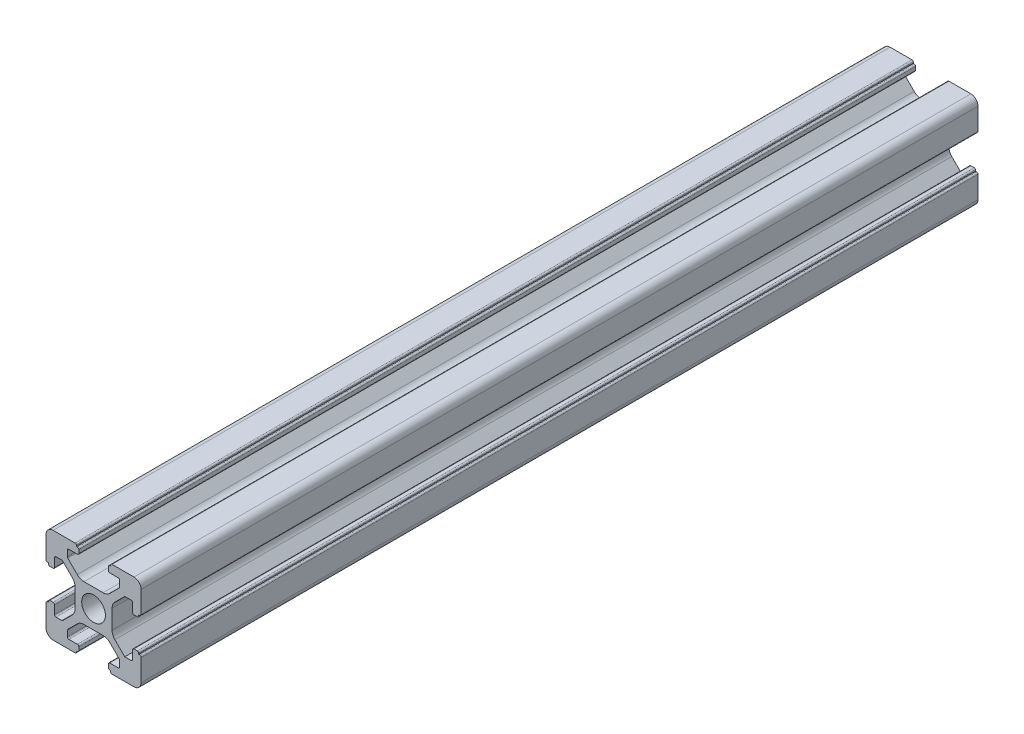
from build123d import *

# Parameters (mm, degrees)
SKETCH_1_R      = 2.5
EXTRUDE_1_DEPTH = 176


with BuildPart() as part:
    # 草图1 → 凸台-拉伸1 (new body)
    with BuildSketch(Plane.XY):
        with BuildLine():
            Line((3.9, 0), (3.9, -2.010912703))
            ThreePointArc((3.9, -2.010912703), (4.052240935, -2.776279568), (4.485786438, -3.425126266))
            Line((4.485786438, -3.425126266), (6.560660172, -5.5))
            Line((6.560660172, -5.5), (7.9, -5.5))
            ThreePointArc((7.9, -5.5), (8.112132034, -5.412132034), (8.2, -5.2))
            Line((8.2, -5.2), (8.2, -3.4))
            ThreePointArc((8.2, -3.4), (8.287867966, -3.187867966), (8.5, -3.1))
            Line((8.5, -3.1), (9.2, -3.1))
            ThreePointArc((9.2, -3.1), (9.412132034, -3.187867966), (9.5, -3.4))
            Line((9.5, -3.4), (9.5, -3.6))
            Line((9.5, -3.6), (9.7, -3.6))
            ThreePointArc((9.7, -3.6), (9.912132034, -3.687867966), (10, -3.9))
            Line((10, -3.9), (10, -8.5))
            ThreePointArc((10, -8.5), (9.560660172, -9.560660172), (8.5, -10))
            Line((8.5, -10), (3.9, -10))
            ThreePointArc((3.9, -10), (3.687867966, -9.912132034), (3.6, -9.7))
            ThreePointArc((3.6, -9.7), (3.541421356, -9.558578644), (3.4, -9.5))
            ThreePointArc((3.4, -9.5), (3.187867966, -9.412132034), (3.1, -9.2))
            Line((3.1, -9.2), (3.1, -8.5))
            ThreePointArc((3.1, -8.5), (3.187867966, -8.287867966), (3.4, -8.2))
            Line((3.4, -8.2), (5.2, -8.2))
            ThreePointArc((5.2, -8.2), (5.412132034, -8.112132034), (5.5, -7.9))
            Line((5.5, -7.9), (5.5, -6.68492424))
            ThreePointArc((5.5, -6.68492424), (5.47716386, -6.570119211), (5.412132034, -6.472792206))
            Line((5.412132034, -6.472792206), (3.425126266, -4.485786438))
            ThreePointArc((3.425126266, -4.485786438), (2.776279568, -4.052240935), (2.010912703, -3.9))
            Line((2.010912703, -3.9), (0, -3.9))
            Line((0, -3.9), (-2.010912703, -3.9))
            ThreePointArc((-2.010912703, -3.9), (-2.776279568, -4.052240935), (-3.425126266, -4.485786438))
            Line((-3.425126266, -4.485786438), (-5.412132034, -6.472792206))
            ThreePointArc((-5.412132034, -6.472792206), (-5.47716386, -6.570119211), (-5.5, -6.68492424))
            Line((-5.5, -6.68492424), (-5.5, -7.9))
            ThreePointArc((-5.5, -7.9), (-5.412132034, -8.112132034), (-5.2, -8.2))
            Line((-5.2, -8.2), (-3.4, -8.2))
            ThreePointArc((-3.4, -8.2), (-3.187867966, -8.287867966), (-3.1, -8.5))
            Line((-3.1, -8.5), (-3.1, -9.2))
            ThreePointArc((-3.1, -9.2), (-3.187867966, -9.412132034), (-3.4, -9.5))
            ThreePointArc((-3.4, -9.5), (-3.541421356, -9.558578644), (-3.6, -9.7))
            ThreePointArc((-3.6, -9.7), (-3.687867966, -9.912132034), (-3.9, -10))
            Line((-3.9, -10), (-8.5, -10))
            ThreePointArc((-8.5, -10), (-9.560660172, -9.560660172), (-10, -8.5))
            Line((-10, -8.5), (-10, -3.9))
            ThreePointArc((-10, -3.9), (-9.912132034, -3.687867966), (-9.7, -3.6))
            Line((-9.7, -3.6), (-9.5, -3.6))
            Line((-9.5, -3.6), (-9.5, -3.4))
            ThreePointArc((-9.5, -3.4), (-9.412132034, -3.187867966), (-9.2, -3.1))
            Line((-9.2, -3.1), (-8.5, -3.1))
            ThreePointArc((-8.5, -3.1), (-8.287867965, -3.187867966), (-8.2, -3.4))
            Line((-8.2, -3.4), (-8.2, -5.2))
            ThreePointArc((-8.2, -5.2), (-8.112132034, -5.412132034), (-7.9, -5.5))
            Line((-7.9, -5.5), (-6.68492424, -5.5))
            ThreePointArc((-6.68492424, -5.5), (-6.570119211, -5.47716386), (-6.472792206, -5.412132034))
            Line((-6.472792206, -5.412132034), (-4.485786438, -3.425126266))
            ThreePointArc((-4.485786438, -3.425126266), (-4.052240935, -2.776279568), (-3.9, -2.010912703))
            Line((-3.9, -2.010912703), (-3.9, 0))
            Line((-3.9, 0), (-3.9, 2.010912703))
            ThreePointArc((-3.9, 2.010912703), (-4.052240935, 2.776279568), (-4.485786438, 3.425126266))
            Line((-4.485786438, 3.425126266), (-6.472792206, 5.412132034))
            ThreePointArc((-6.472792206, 5.412132034), (-6.570119211, 5.47716386), (-6.68492424, 5.5))
            Line((-6.68492424, 5.5), (-7.9, 5.5))
            ThreePointArc((-7.9, 5.5), (-8.112132034, 5.412132034), (-8.2, 5.2))
            Line((-8.2, 5.2), (-8.2, 3.4))
            ThreePointArc((-8.2, 3.4), (-8.287867965, 3.187867966), (-8.5, 3.1))
            Line((-8.5, 3.1), (-9.2, 3.1))
            ThreePointArc((-9.2, 3.1), (-9.412132034, 3.187867966), (-9.5, 3.4))
            Line((-9.5, 3.4), (-9.5, 3.6))
            Line((-9.5, 3.6), (-9.7, 3.6))
            ThreePointArc((-9.7, 3.6), (-9.912132034, 3.687867966), (-10, 3.9))
            Line((-10, 3.9), (-10, 8.5))
            ThreePointArc((-10, 8.5), (-9.560660172, 9.560660172), (-8.5, 10))
            Line((-8.5, 10), (-3.9, 10))
            ThreePointArc((-3.9, 10), (-3.687867966, 9.912132034), (-3.6, 9.7))
            Line((-3.6, 9.7), (-3.6, 9.5))
            Line((-3.6, 9.5), (-3.4, 9.5))
            ThreePointArc((-3.4, 9.5), (-3.187867966, 9.412132034), (-3.1, 9.2))
            Line((-3.1, 9.2), (-3.1, 8.5))
            ThreePointArc((-3.1, 8.5), (-3.187867966, 8.287867966), (-3.4, 8.2))
            Line((-3.4, 8.2), (-5.2, 8.2))
            ThreePointArc((-5.2, 8.2), (-5.412132034, 8.112132034), (-5.5, 7.9))
            Line((-5.5, 7.9), (-5.5, 6.68492424))
            ThreePointArc((-5.5, 6.68492424), (-5.47716386, 6.570119211), (-5.412132034, 6.472792206))
            Line((-5.412132034, 6.472792206), (-3.425126266, 4.485786438))
            ThreePointArc((-3.425126266, 4.485786438), (-2.776279568, 4.052240935), (-2.010912703, 3.9))
            Line((-2.010912703, 3.9), (0, 3.9))
            Line((0, 3.9), (2.010912703, 3.9))
            ThreePointArc((2.010912703, 3.9), (2.776279568, 4.052240935), (3.425126266, 4.485786438))
            Line((3.425126266, 4.485786438), (5.412132034, 6.472792206))
            ThreePointArc((5.412132034, 6.472792206), (5.47716386, 6.570119211), (5.5, 6.68492424))
            Line((5.5, 6.68492424), (5.5, 7.9))
            ThreePointArc((5.5, 7.9), (5.412132034, 8.112132034), (5.2, 8.2))
            Line((5.2, 8.2), (3.4, 8.2))
            ThreePointArc((3.4, 8.2), (3.187867966, 8.287867966), (3.1, 8.5))
            Line((3.1, 8.5), (3.1, 9.2))
            ThreePointArc((3.1, 9.2), (3.187867966, 9.412132034), (3.4, 9.5))
            Line((3.4, 9.5), (3.6, 9.5))
            Line((3.6, 9.5), (3.6, 9.7))
            ThreePointArc((3.6, 9.7), (3.687867966, 9.912132034), (3.9, 10))
            Line((3.9, 10), (8.5, 10))
            ThreePointArc((8.5, 10), (9.560660172, 9.560660172), (10, 8.5))
            Line((10, 8.5), (10, 3.9))
            ThreePointArc((10, 3.9), (9.912132034, 3.687867966), (9.7, 3.6))
            Line((9.7, 3.6), (9.5, 3.6))
            Line((9.5, 3.6), (9.5, 3.4))
            ThreePointArc((9.5, 3.4), (9.412132034, 3.187867966), (9.2, 3.1))
            Line((9.2, 3.1), (8.5, 3.1))
            ThreePointArc((8.5, 3.1), (8.287867966, 3.187867966), (8.2, 3.4))
            Line((8.2, 3.4), (8.2, 5.2))
            ThreePointArc((8.2, 5.2), (8.112132034, 5.412132034), (7.9, 5.5))
            Line((7.9, 5.5), (6.68492424, 5.5))
            ThreePointArc((6.68492424, 5.5), (6.570119211, 5.47716386), (6.472792206, 5.412132034))
            Line((6.472792206, 5.412132034), (4.485786438, 3.425126266))
            ThreePointArc((4.485786438, 3.425126266), (4.052240935, 2.776279568), (3.9, 2.010912703))
            Line((3.9, 2.010912703), (3.9, 0))
        make_face()
        Circle(SKETCH_1_R, mode=Mode.SUBTRACT)
    extrude(amount=EXTRUDE_1_DEPTH)


solid = part.part
